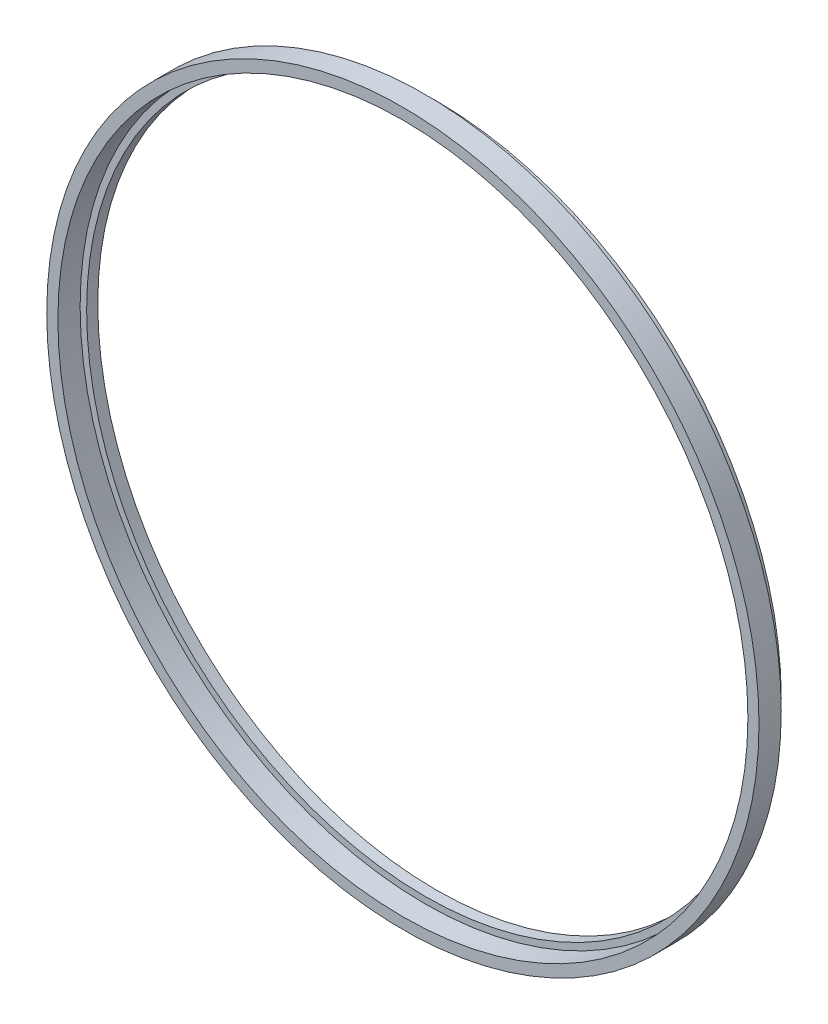
from build123d import *

# Parameters (mm, degrees)
SKETCH1_R           = 64
SKETCH1_R_2         = 62
BOSS_EXTRUDE1_DEPTH = 4
BOSS_EXTRUDE2_START = 2
SKETCH2_R           = 62
SKETCH2_R_2         = 60.83
BOSS_EXTRUDE2_DEPTH = 2


with BuildPart() as part:
    # Sketch1 → Boss-Extrude1 (new body)
    with BuildSketch(Plane.XY):
        Circle(SKETCH1_R)
        Circle(SKETCH1_R_2, mode=Mode.SUBTRACT)
    extrude(amount=BOSS_EXTRUDE1_DEPTH)


with BuildPart() as body_2:
    # Sketch2 → Boss-Extrude2 (new body)
    with BuildSketch(Plane(origin=(0, 0, 0), x_dir=(-1, 0, 0), z_dir=(0, 0, -1)).offset(BOSS_EXTRUDE2_START)):
        Circle(SKETCH2_R)
        Circle(SKETCH2_R_2, mode=Mode.SUBTRACT)
    extrude(amount=-BOSS_EXTRUDE2_DEPTH)


solid = Compound([part.part, body_2.part])
